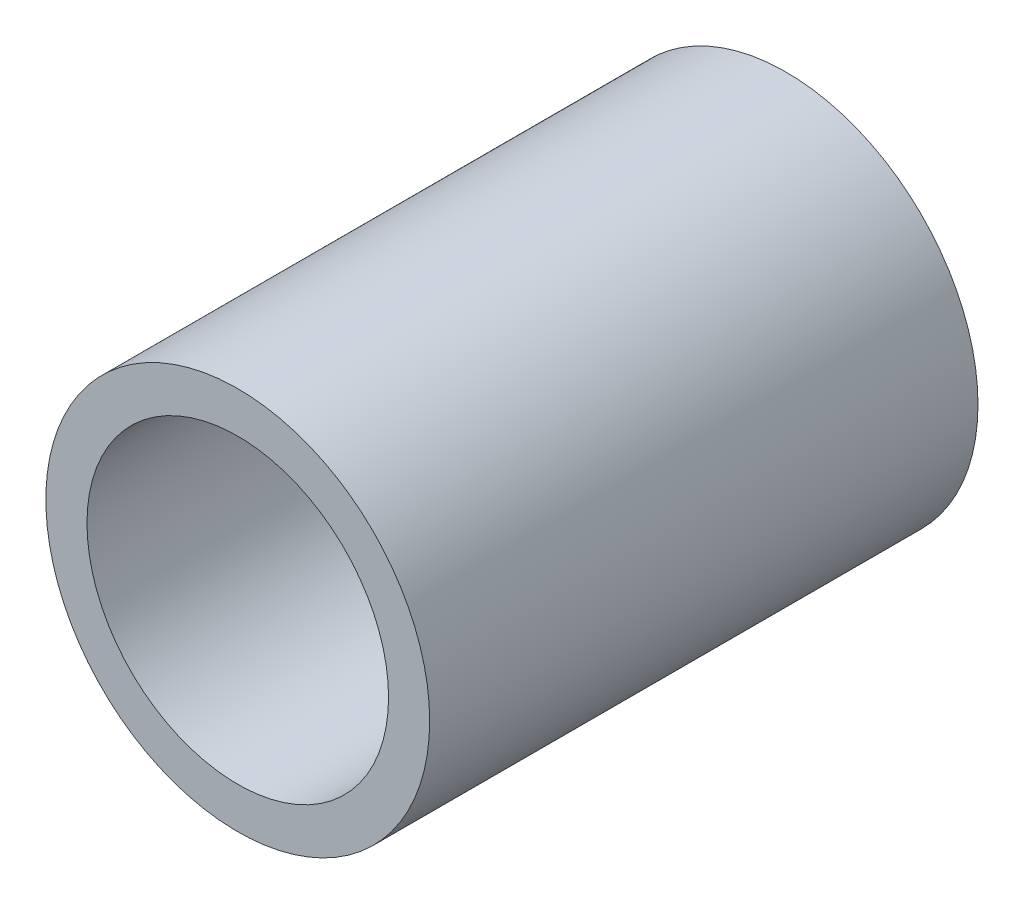
from build123d import *

# Parameters (mm, degrees)
SKETCH2_R           = 3.5
SKETCH2_R_2         = 2.75
BOSS_EXTRUDE1_DEPTH = 10
SKETCH2_3_R         = 2.75
SKETCH2_3_R_2       = 1.8
BOSS_EXTRUDE2_DEPTH = 3


with BuildPart() as part:
    # Sketch2 → Boss-Extrude1 (new body)
    with BuildSketch(Plane.XY.offset(6.964339655)):
        with Locations((234.294911568, 5.279687523)):
            Circle(SKETCH2_R)
        with Locations((234.294911568, 5.279687523)):
            Circle(SKETCH2_R_2, mode=Mode.SUBTRACT)
    extrude(amount=BOSS_EXTRUDE1_DEPTH)

    # Sketch2<3> → Boss-Extrude2 (add)
    with BuildSketch(Plane.XY.offset(6.964339655)):
        with Locations((234.294911568, 5.279687523)):
            Circle(SKETCH2_3_R)
        with Locations((234.294911568, 5.279687523)):
            Circle(SKETCH2_3_R_2, mode=Mode.SUBTRACT)
    extrude(amount=BOSS_EXTRUDE2_DEPTH)


solid = part.part
